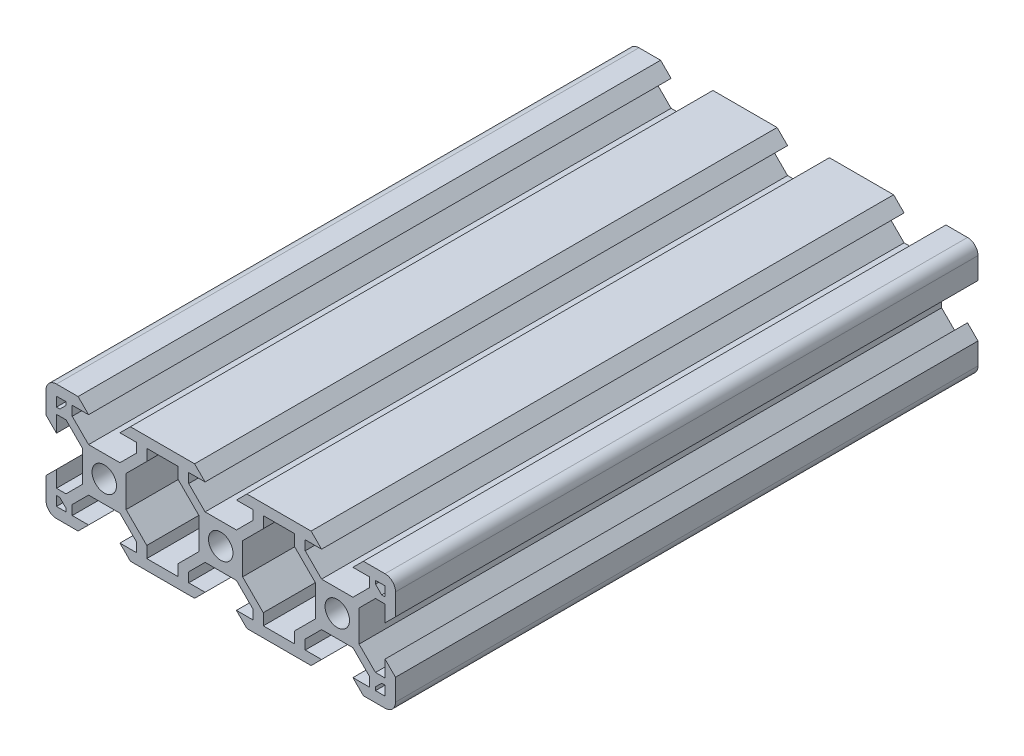
from build123d import *

# Parameters (mm, degrees)
ESQUISSE1_R        = 2.1
BOSS_EXTRU_1_DEPTH = 50


with BuildPart() as part:
    # Esquisse1 → Boss.-Extru.1 (new, symmetric)
    with BuildSketch(Plane.XY):
        with BuildLine():
            Line((-20, 3.750660172), (-22.69, 3.750660172))
            Line((-22.69, 3.750660172), (-25.499339828, 6.56))
            Line((-25.499339828, 6.56), (-25.499339828, 8.2))
            Line((-25.499339828, 8.2), (-22.69, 8.2))
            Line((-22.69, 8.2), (-24.49, 10))
            Line((-24.49, 10), (-28.2, 10))
            ThreePointArc((-28.2, 10), (-29.472792206, 9.472792206), (-30, 8.2))
            Line((-30, 8.2), (-30, 4.49))
            Line((-30, 4.49), (-28.2, 2.69))
            Line((-28.2, 2.69), (-28.2, 5.499339828))
            Line((-28.2, 5.499339828), (-26.56, 5.499339828))
            Line((-26.56, 5.499339828), (-23.750660172, 2.69))
            Line((-23.750660172, 2.69), (-23.750660172, 0))
            Line((-23.750660172, 0), (-23.750660172, -2.69))
            Line((-23.750660172, -2.69), (-26.56, -5.499339828))
            Line((-26.56, -5.499339828), (-28.2, -5.499339828))
            Line((-28.2, -5.499339828), (-28.2, -2.69))
            Line((-28.2, -2.69), (-30, -4.49))
            Line((-30, -4.49), (-30, -8.2))
            ThreePointArc((-30, -8.2), (-29.472792206, -9.472792206), (-28.2, -10))
            Line((-28.2, -10), (-24.49, -10))
            Line((-24.49, -10), (-22.69, -8.2))
            Line((-22.69, -8.2), (-25.499339828, -8.2))
            Line((-25.499339828, -8.2), (-25.499339828, -6.56))
            Line((-25.499339828, -6.56), (-22.69, -3.750660172))
            Line((-22.69, -3.750660172), (-20, -3.750660172))
            Line((-20, -3.750660172), (-17.31, -3.750660172))
            Line((-17.31, -3.750660172), (-14.500660172, -6.56))
            Line((-14.500660172, -6.56), (-14.500660172, -8.2))
            Line((-14.500660172, -8.2), (-17.31, -8.2))
            Line((-17.31, -8.2), (-15.51, -10))
            Line((-15.51, -10), (-4.49, -10))
            Line((-4.49, -10), (-2.69, -8.2))
            Line((-2.69, -8.2), (-5.499339828, -8.2))
            Line((-5.499339828, -8.2), (-5.499339828, -6.56))
            Line((-5.499339828, -6.56), (-2.69, -3.750660172))
            Line((-2.69, -3.750660172), (2.69, -3.750660172))
            Line((2.69, -3.750660172), (5.499339828, -6.56))
            Line((5.499339828, -6.56), (5.499339828, -8.2))
            Line((5.499339828, -8.2), (2.69, -8.2))
            Line((2.69, -8.2), (4.49, -10))
            Line((4.49, -10), (15.51, -10))
            Line((15.51, -10), (17.31, -8.2))
            Line((17.31, -8.2), (14.500660172, -8.2))
            Line((14.500660172, -8.2), (14.500660172, -6.56))
            Line((14.500660172, -6.56), (17.31, -3.750660172))
            Line((17.31, -3.750660172), (20, -3.750660172))
            Line((20, -3.750660172), (22.69, -3.750660172))
            Line((22.69, -3.750660172), (25.499339828, -6.56))
            Line((25.499339828, -6.56), (25.499339828, -8.2))
            Line((25.499339828, -8.2), (22.69, -8.2))
            Line((22.69, -8.2), (24.49, -10))
            Line((24.49, -10), (28.2, -10))
            ThreePointArc((28.2, -10), (29.472792206, -9.472792206), (30, -8.2))
            Line((30, -8.2), (30, -4.49))
            Line((30, -4.49), (28.2, -2.69))
            Line((28.2, -2.69), (28.2, -5.499339828))
            Line((28.2, -5.499339828), (26.56, -5.499339828))
            Line((26.56, -5.499339828), (23.750660172, -2.69))
            Line((23.750660172, -2.69), (23.750660172, 0))
            Line((23.750660172, 0), (23.750660172, 2.69))
            Line((23.750660172, 2.69), (26.56, 5.499339828))
            Line((26.56, 5.499339828), (28.2, 5.499339828))
            Line((28.2, 5.499339828), (28.2, 2.69))
            Line((28.2, 2.69), (30, 4.49))
            Line((30, 4.49), (30, 8.2))
            ThreePointArc((30, 8.2), (29.472792206, 9.472792206), (28.2, 10))
            Line((28.2, 10), (24.49, 10))
            Line((24.49, 10), (22.69, 8.2))
            Line((22.69, 8.2), (25.499339828, 8.2))
            Line((25.499339828, 8.2), (25.499339828, 6.56))
            Line((25.499339828, 6.56), (22.69, 3.750660172))
            Line((22.69, 3.750660172), (20, 3.750660172))
            Line((20, 3.750660172), (17.31, 3.750660172))
            Line((17.31, 3.750660172), (14.500660172, 6.56))
            Line((14.500660172, 6.56), (14.500660172, 8.2))
            Line((14.500660172, 8.2), (17.31, 8.2))
            Line((17.31, 8.2), (15.51, 10))
            Line((15.51, 10), (4.49, 10))
            Line((4.49, 10), (2.69, 8.2))
            Line((2.69, 8.2), (5.499339828, 8.2))
            Line((5.499339828, 8.2), (5.499339828, 6.56))
            Line((5.499339828, 6.56), (2.69, 3.750660172))
            Line((2.69, 3.750660172), (-2.69, 3.750660172))
            Line((-2.69, 3.750660172), (-5.499339828, 6.56))
            Line((-5.499339828, 6.56), (-5.499339828, 8.2))
            Line((-5.499339828, 8.2), (-2.69, 8.2))
            Line((-2.69, 8.2), (-4.49, 10))
            Line((-4.49, 10), (-15.51, 10))
            Line((-15.51, 10), (-17.31, 8.2))
            Line((-17.31, 8.2), (-14.500660172, 8.2))
            Line((-14.500660172, 8.2), (-14.500660172, 6.56))
            Line((-14.500660172, 6.56), (-17.31, 3.750660172))
            Line((-17.31, 3.750660172), (-20, 3.750660172))
        make_face()
        Circle(ESQUISSE1_R, mode=Mode.SUBTRACT)
        with Locations((-20, 0)):
            Circle(ESQUISSE1_R, mode=Mode.SUBTRACT)
        with Locations((20, 0)):
            Circle(ESQUISSE1_R, mode=Mode.SUBTRACT)
        Polygon((-28.2, 8.2), (-28.2, 6.569339828), (-27.63, 6.569339828), (-26.569339828, 7.63), (-26.569339828, 8.2), align=None, mode=Mode.SUBTRACT)
        Polygon((-26.569339828, -7.63), (-27.63, -6.569339828), (-28.2, -6.569339828), (-28.2, -8.2), (-26.569339828, -8.2), align=None, mode=Mode.SUBTRACT)
        Polygon((-7.300660172, -8.2), (-7.300660172, -6.24), (-3.750660172, -2.69), (-3.750660172, 2.69), (-7.300660172, 6.24), (-7.300660172, 8.2), (-12.699339828, 8.2), (-12.699339828, 6.24), (-16.249339828, 2.69), (-16.249339828, -2.69), (-12.699339828, -6.24), (-12.699339828, -8.2), align=None, mode=Mode.SUBTRACT)
        Polygon((26.569339828, 8.2), (28.2, 8.2), (28.2, 6.569339828), (27.63, 6.569339828), (26.569339828, 7.63), align=None, mode=Mode.SUBTRACT)
        Polygon((26.569339828, -8.2), (26.569339828, -7.63), (27.63, -6.569339828), (28.2, -6.569339828), (28.2, -8.2), align=None, mode=Mode.SUBTRACT)
        Polygon((7.300660172, 8.2), (7.300660172, 6.24), (3.750660172, 2.69), (3.750660172, -2.69), (7.300660172, -6.24), (7.300660172, -8.2), (12.699339828, -8.2), (12.699339828, -6.24), (16.249339828, -2.69), (16.249339828, 2.69), (12.699339828, 6.24), (12.699339828, 8.2), align=None, mode=Mode.SUBTRACT)
    extrude(amount=BOSS_EXTRU_1_DEPTH, both=True)


solid = part.part
